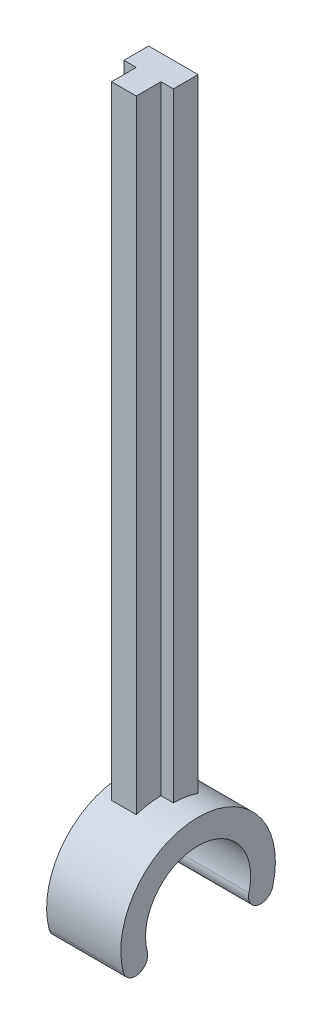
from build123d import *

# Parameters (mm, degrees)
BOSS_EXTRUDE1_DEPTH      = 4
BOSS_EXTRUDE1_DEPTH_BACK = 2
BOSS_EXTRUDE2_DEPTH      = 2
BOSS_EXTRUDE2_DEPTH_BACK = 2
BOSS_EXTRUDE3_DEPTH      = 1
BOSS_EXTRUDE3_DEPTH_BACK = 1
SKETCH3_W                = 2
SKETCH3_H                = 52


with BuildPart() as part:
    # Sketch1 → Boss-Extrude1 (new, two sides: drawn at the far end of the back side and taken through both)
    with BuildSketch(Plane(origin=(0, 0, 0), x_dir=(0, 0, -1), z_dir=(1, 0, 0)).offset(-BOSS_EXTRUDE1_DEPTH_BACK)):
        with BuildLine():
            ThreePointArc((-4.105184762, -1.099980942), (0, 4.25), (4.105184762, -1.099980942))
            ThreePointArc((4.105184762, -1.099980942), (4.812291543, -2.324725813), (6.037036414, -1.617619032))
            ThreePointArc((6.037036414, -1.617619032), (0, 6.25), (-6.037036414, -1.617619032))
            ThreePointArc((-6.037036414, -1.617619032), (-4.812291543, -2.324725813), (-4.105184762, -1.099980942))
        make_face()
    extrude(amount=BOSS_EXTRUDE1_DEPTH + BOSS_EXTRUDE1_DEPTH_BACK)

    # Sketch2 → Boss-Extrude2 (add, two sides: drawn at the far end of the back side and taken through both)
    with BuildSketch(Plane(origin=(0, 0, 0), x_dir=(0, 0, -1), z_dir=(1, 0, 0)).offset(-BOSS_EXTRUDE2_DEPTH_BACK)):
        Polygon((0, 6.25), (0, 4.25), (2, 4.25), (2, 56.25), (0, 56.25), align=None)
    extrude(amount=BOSS_EXTRUDE2_DEPTH + BOSS_EXTRUDE2_DEPTH_BACK)

    # Sketch3 → Boss-Extrude3 (add, two sides: drawn at the far end of the back side and taken through both)
    with BuildSketch(Plane(origin=(0, 0, 0), x_dir=(0, 0, -1), z_dir=(1, 0, 0)).offset(-BOSS_EXTRUDE3_DEPTH_BACK)):
        with Locations((-1, 30.25)):
            Rectangle(SKETCH3_W, SKETCH3_H)
    extrude(amount=BOSS_EXTRUDE3_DEPTH + BOSS_EXTRUDE3_DEPTH_BACK)


solid = part.part
